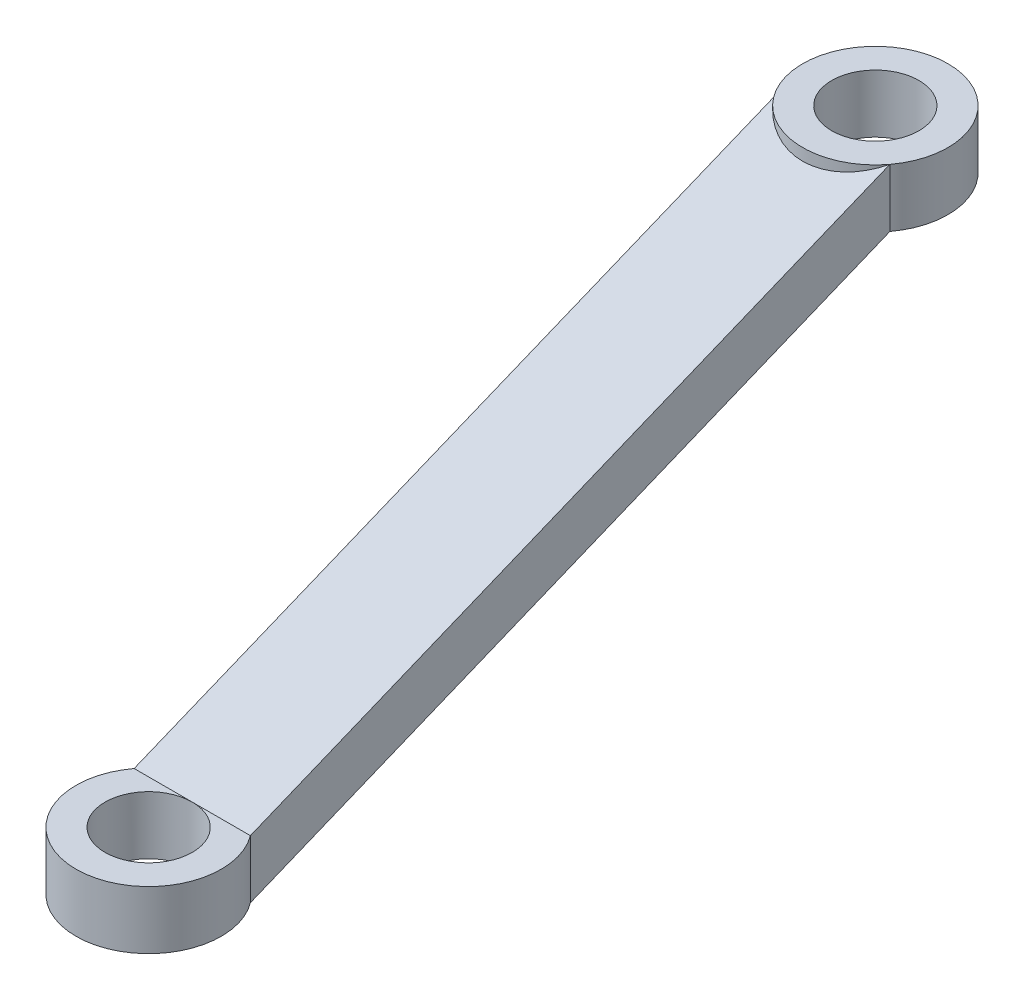
from build123d import *

# Parameters (mm, degrees)
BOSS_EXTRUDE1_DEPTH = 4
SKETCH2_R           = 2.5
BOSS_EXTRUDE2_DEPTH = 2
SKETCH3_R           = 2.5
BOSS_EXTRUDE3_DEPTH = 2
SKETCH4_R           = 1.5
CUT_EXTRUDE1_DEPTH  = 28.879203719
SKETCH5_R           = 1.5
CUT_EXTRUDE2_DEPTH  = 29.587584718


with BuildPart() as part:
    # Sketch1 → Boss-Extrude1 (new body)
    with BuildSketch(Plane(origin=(0, 0, 0), x_dir=(0, 0, -1), z_dir=(1, 0, 0))):
        Polygon((0, 0), (0, 2), (22, 11), (22, 9), align=None)
    extrude(amount=BOSS_EXTRUDE1_DEPTH)

    # Sketch2 → Boss-Extrude2 (add)
    with BuildSketch(Plane(origin=(0, 0, 0), x_dir=(1, 0, 0), z_dir=(0, 1, 0))):
        with Locations((2, -1.5)):
            Circle(SKETCH2_R)
    extrude(amount=BOSS_EXTRUDE2_DEPTH)

    # Sketch3 → Boss-Extrude3 (add)
    with BuildSketch(Plane(origin=(0, 9, 0), x_dir=(-1, 0, 0), z_dir=(0, -1, 0))):
        with Locations((-2, 23.5)):
            Circle(SKETCH3_R)
    extrude(amount=-BOSS_EXTRUDE3_DEPTH)

    # Sketch4 → Cut-Extrude1 (cut, through all)
    with BuildSketch(Plane(origin=(0, 2, 0), x_dir=(1, 0, 0), z_dir=(0, 1, 0))):
        with Locations(Location((2, -1.5, 0), (0, 0, 270))):
            Circle(SKETCH4_R)
    extrude(amount=-CUT_EXTRUDE1_DEPTH, mode=Mode.SUBTRACT)

    # Sketch5 → Cut-Extrude2 (cut, through all)
    with BuildSketch(Plane(origin=(0, 11, 0), x_dir=(1, 0, 0), z_dir=(0, 1, 0))):
        with Locations(Location((2, 23.5, 0), (0, 0, 270))):
            Circle(SKETCH5_R)
    extrude(amount=-CUT_EXTRUDE2_DEPTH, mode=Mode.SUBTRACT)


solid = part.part
